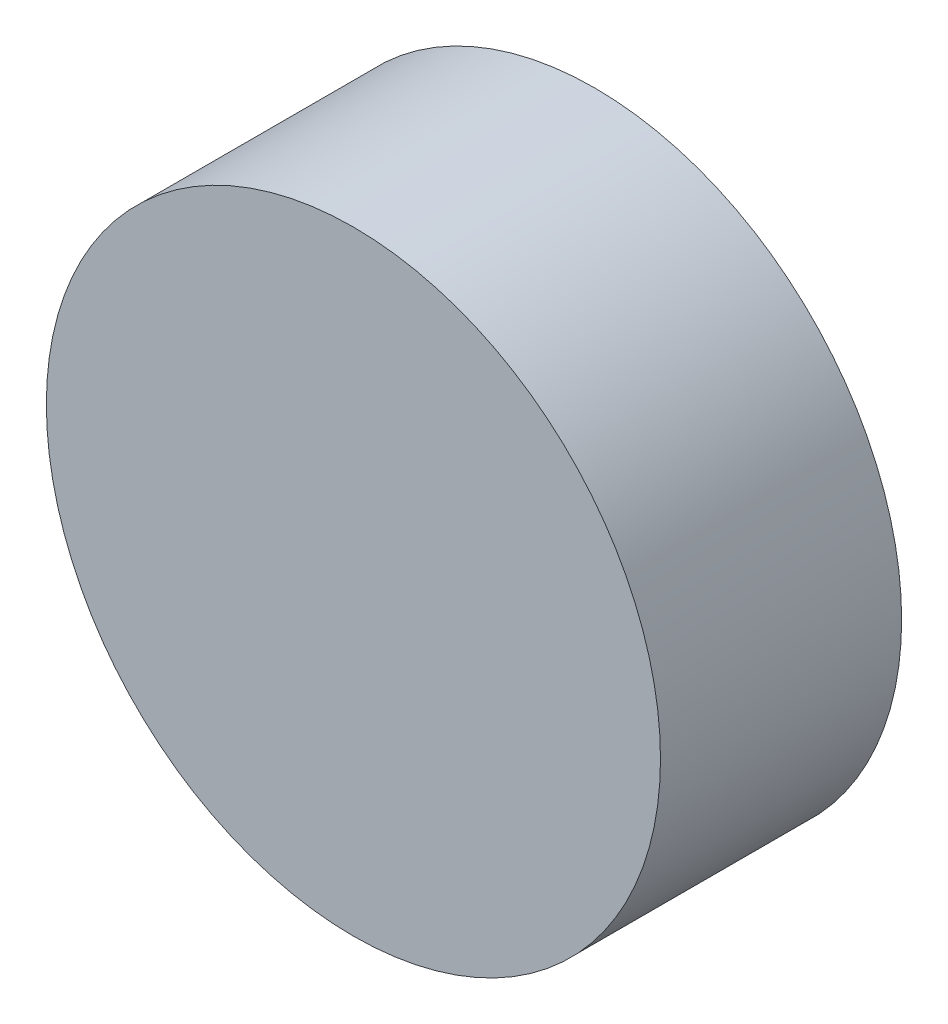
from build123d import *

# Parameters (mm, degrees)
SKETCH1_R           = 34
BOSS_EXTRUDE1_DEPTH = 26.7


with BuildPart() as part:
    # Sketch1 → Boss-Extrude1 (new body)
    with BuildSketch(Plane.XY):
        Circle(SKETCH1_R)
    extrude(amount=BOSS_EXTRUDE1_DEPTH)


solid = part.part
